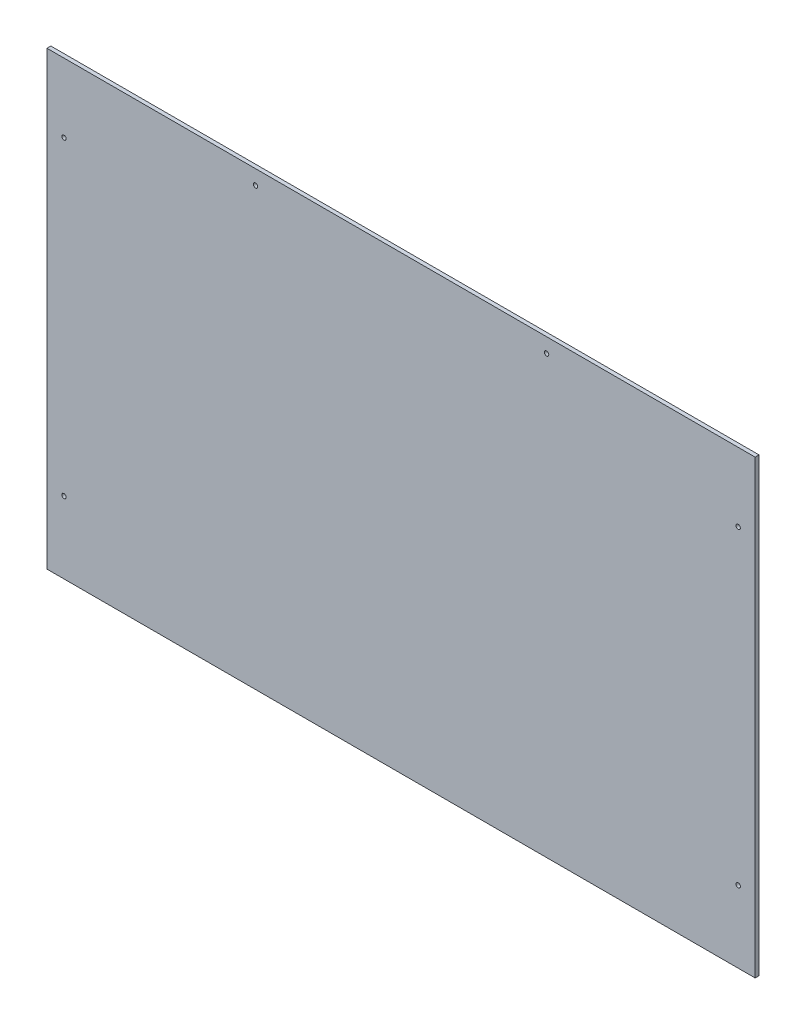
from build123d import *

# Parameters (mm, degrees)
SKETCH1_W           = 730
SKETCH1_H           = 465
BOSS_EXTRUDE1_DEPTH = 2
SKETCH2_R           = 2.25
CUT_EXTRUDE1_DEPTH  = 592.156493663


with BuildPart() as part:
    # Sketch1 → Boss-Extrude1 (new, symmetric)
    with BuildSketch(Plane.XY):
        with Locations((0, -232.5)):
            Rectangle(SKETCH1_W, SKETCH1_H)
    extrude(amount=BOSS_EXTRUDE1_DEPTH, both=True)

    # Sketch2 → Cut-Extrude1 (cut, through all)
    with BuildSketch(Plane.XY.offset(2)):
        with Locations((-150, -15)):
            Circle(SKETCH2_R)
        with Locations((150, -15)):
            Circle(SKETCH2_R)
        with Locations((-347.5, -71)):
            Circle(SKETCH2_R)
        with Locations((-347.5, -391)):
            Circle(SKETCH2_R)
        with Locations(Location((347.5, -391, 0), (0, 0, 180))):
            Circle(SKETCH2_R)
        with Locations(Location((347.5, -71, 0), (0, 0, 180))):
            Circle(SKETCH2_R)
    extrude(amount=-CUT_EXTRUDE1_DEPTH, mode=Mode.SUBTRACT)


solid = part.part
